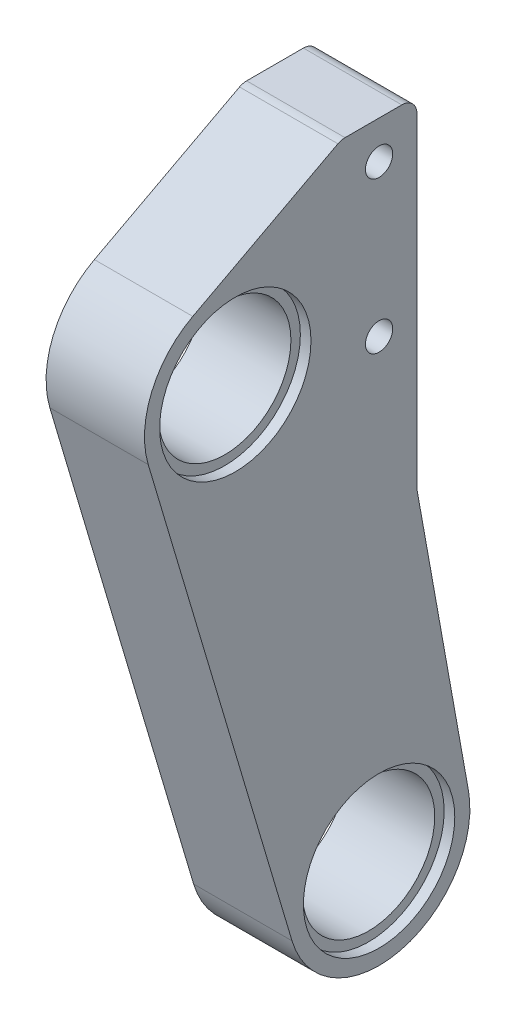
from build123d import *

# Parameters (mm, degrees)
SKETCH1_R           = 2.286
SKETCH1_R_2         = 11.1125
BOSS_EXTRUDE1_DEPTH = 16.51
SKETCH2_R           = 12.7
CUT_EXTRUDE1_DEPTH  = 1.778
FILLET1_R           = 2.54


with BuildPart() as part:
    # Sketch1 → Boss-Extrude1 (new body)
    with BuildSketch(Plane(origin=(0, 0, 0), x_dir=(0, 0, -1), z_dir=(1, 0, 0))):
        with BuildLine():
            Line((-38.739778242, 0.742722084), (-14.609778242, -80.537277916))
            ThreePointArc((-14.609778242, -80.537277916), (3.522565818, -91.027310277), (14.999447267, -73.502930908))
            Line((14.999447267, -73.502930908), (6.35, -25.4))
            Line((6.35, -25.4), (6.35, 31.75))
            Line((6.35, 31.75), (-6.35, 31.75))
            Line((-6.35, 31.75), (-31.266140037, 18.54599812))
            ThreePointArc((-31.266140037, 18.54599812), (-38.182060342, 10.978915167), (-38.739778242, 0.742722084))
        make_face()
        Circle(SKETCH1_R, mode=Mode.SUBTRACT)
        with Locations((0, 25.4)):
            Circle(SKETCH1_R, mode=Mode.SUBTRACT)
        with Locations((0, -76.2)):
            Circle(SKETCH1_R_2, mode=Mode.SUBTRACT)
        with Locations((-24.13, 5.08)):
            Circle(SKETCH1_R_2, mode=Mode.SUBTRACT)
    extrude(amount=BOSS_EXTRUDE1_DEPTH)

    # Sketch2 → Cut-Extrude1 (cut)
    with BuildSketch(Plane(origin=(16.51, 0, 0), x_dir=(0, 0, -1), z_dir=(1, 0, 0))):
        with Locations((0, -76.2)):
            Circle(SKETCH2_R)
        with Locations((-24.13, 5.08)):
            Circle(SKETCH2_R)
    extrude(amount=-CUT_EXTRUDE1_DEPTH, mode=Mode.SUBTRACT)

    # Fillet1
    fillet1_edges = [part.edges().sort_by_distance(p)[0] for p in [
        (8.255, 31.75, 6.35),
        (8.255, 31.75, -6.35),
        (8.255, -25.4, -6.35),
    ]]
    fillet(fillet1_edges, radius=FILLET1_R)


solid = part.part
